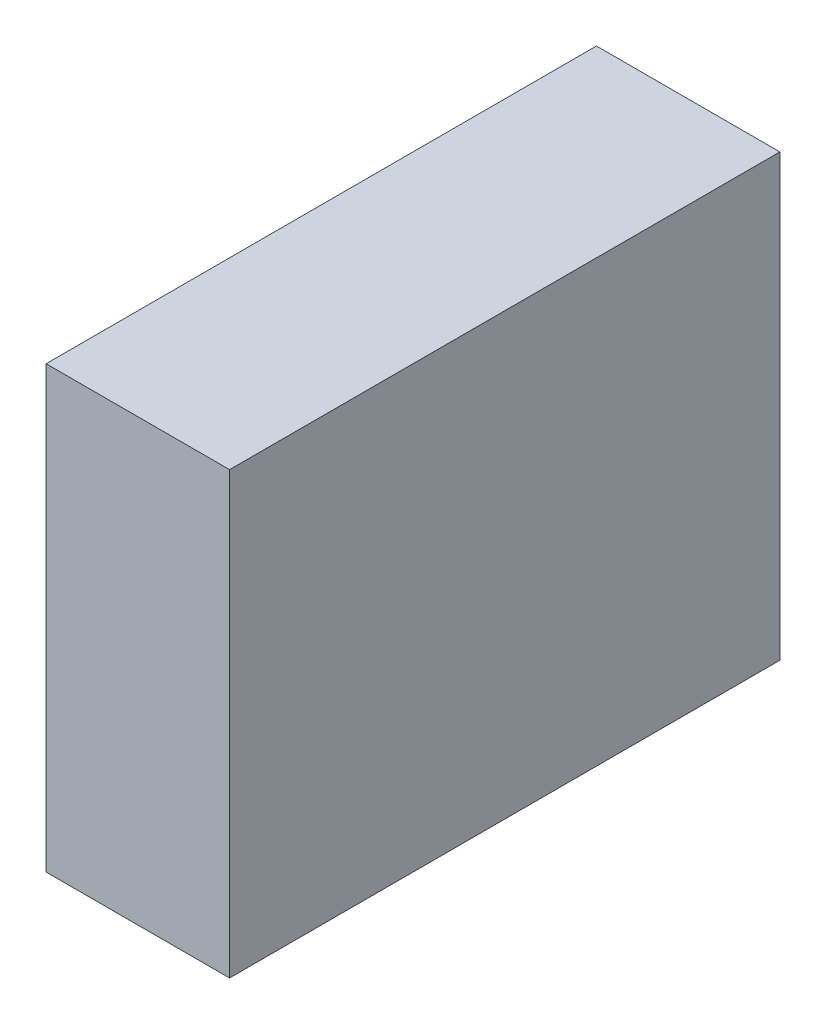
from build123d import *

# Parameters (mm, degrees)
SKETCH1_W           = 5
SKETCH1_H           = 15
BOSS_EXTRUDE1_DEPTH = 12


with BuildPart() as part:
    # Sketch1 → Boss-Extrude1 (new body)
    with BuildSketch(Plane(origin=(0, 0, 0), x_dir=(1, 0, 0), z_dir=(0, 1, 0))):
        with Locations((24.864864865, 75.101351351)):
            Rectangle(SKETCH1_W, SKETCH1_H)
    extrude(amount=BOSS_EXTRUDE1_DEPTH)


solid = part.part
